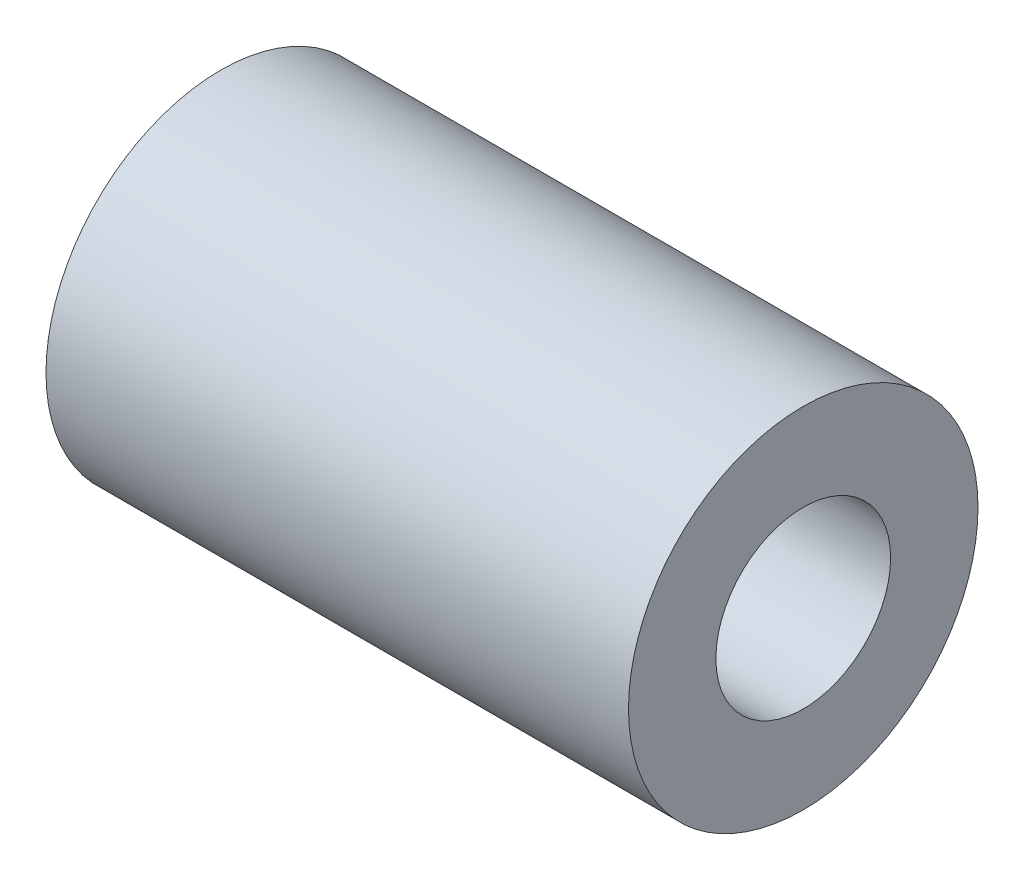
from build123d import *

# Parameters (mm, degrees)
SKETCH_1_R      = 3
SKETCH_1_R_2    = 1.5
EXTRUDE_1_DEPTH = 10


with BuildPart() as part:
    # 草图1 → 凸台-拉伸1 (new body)
    with BuildSketch(Plane(origin=(0, 0, 0), x_dir=(0, 0, -1), z_dir=(1, 0, 0))):
        Circle(SKETCH_1_R)
        Circle(SKETCH_1_R_2, mode=Mode.SUBTRACT)
    extrude(amount=EXTRUDE_1_DEPTH)


solid = part.part
